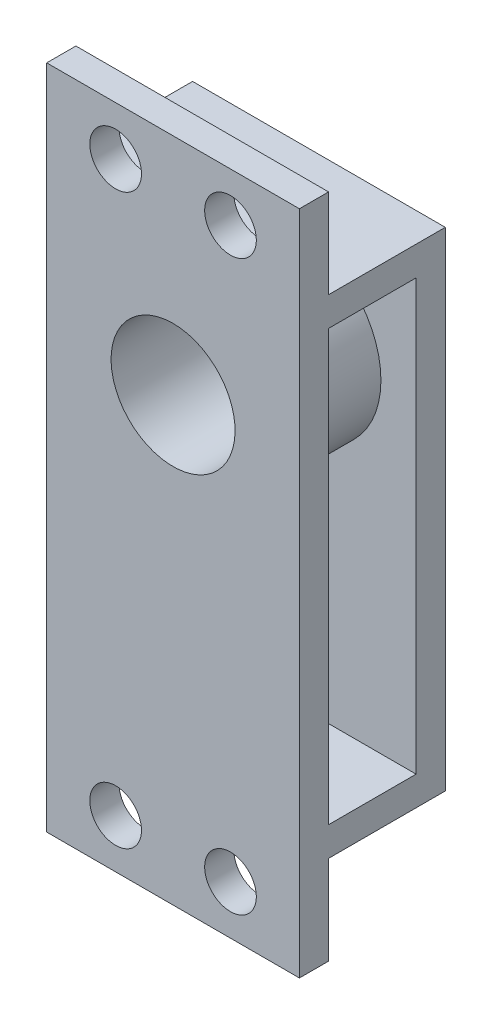
from build123d import *

# Parameters (mm, degrees)
SKETCH1_W            = 22
SKETCH1_H            = 58
BOSS_EXTRUDE1_DEPTH  = 2.54
EXTRUDE_THIN2_DEPTH  = 22
SKETCH7_R            = 7.9375
SKETCH7_R_2          = 5.3975
BOSS_EXTRUDE2_DEPTH  = 10.16
SKETCH8_R            = 5.3975
CUT_EXTRUDE1_DEPTH   = 34.515518794
M4_CLEARANCE_HOLE1_D = 4.5


with BuildPart() as part:
    # Sketch1 → Boss-Extrude1 (new body)
    with BuildSketch(Plane.XY):
        Rectangle(SKETCH1_W, SKETCH1_H)
    extrude(amount=BOSS_EXTRUDE1_DEPTH)

    # Sketch6 → Extrude-Thin2 (add)
    with BuildSketch(Plane.ZY.offset(11)):
        Polygon((0, 21.25), (-10.16, 21.25), (-10.16, -21.25), (0, -21.25), (0, -18.71), (-7.62, -18.71), (-7.62, 18.71), (0, 18.71), align=None)
    extrude(amount=-EXTRUDE_THIN2_DEPTH)

    # Sketch7 → Boss-Extrude2 (add)
    with BuildSketch(Plane(origin=(0, 0, -10.16), x_dir=(-1, 0, 0), z_dir=(0, 0, -1))):
        with Locations(Location((0, 9.4592, 0), (0, 0, 90))):
            Circle(SKETCH7_R)
        with Locations(Location((0, 9.4592, 0), (0, 0, 90))):
            Circle(SKETCH7_R_2, mode=Mode.SUBTRACT)
    extrude(amount=-BOSS_EXTRUDE2_DEPTH)

    # Sketch8 → Cut-Extrude1 (cut, through all)
    with BuildSketch(Plane(origin=(0, 0, -10.16), x_dir=(-1, 0, 0), z_dir=(0, 0, -1))):
        with Locations(Location((0, 9.4592, 0), (0, 0, 90))):
            Circle(SKETCH8_R)
    extrude(amount=-CUT_EXTRUDE1_DEPTH, mode=Mode.SUBTRACT)

    # M4 Clearance Hole1 (through all)
    with Locations(Plane(origin=(0, 0, 0), x_dir=(-1, 0, 0), z_dir=(0, 0, -1))):
        with Locations((-5, 24.75), (5, 24.75), (-5, -24.75), (5, -24.75)):
            Hole(M4_CLEARANCE_HOLE1_D / 2)


solid = part.part
